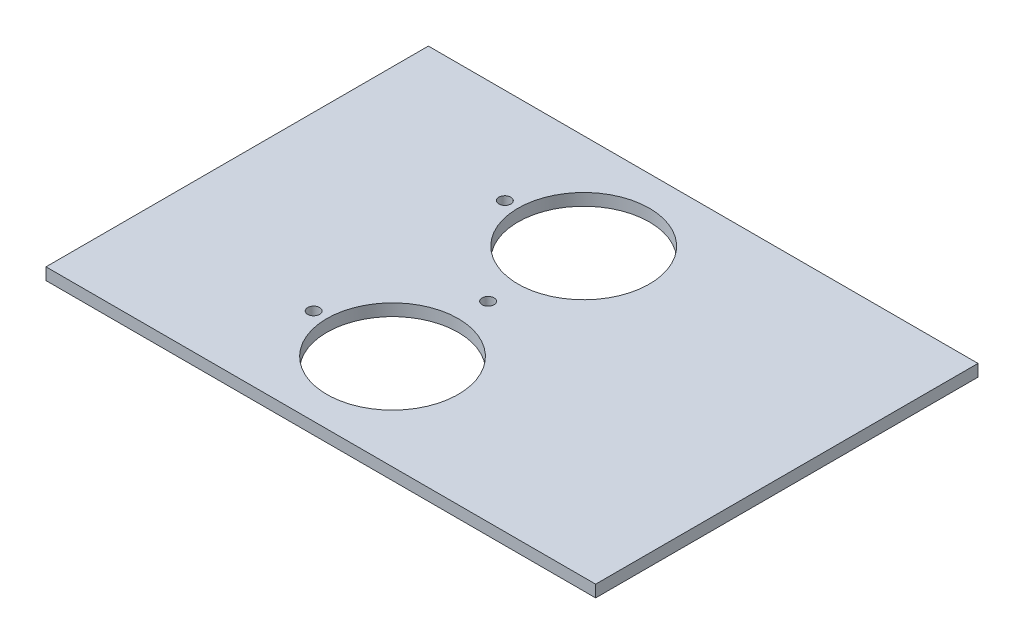
from build123d import *

# Parameters (mm, degrees)
SKETCH_1_W          = 250
SKETCH_1_H          = 160
EXTRUDE_1_DEPTH     = 5
CUT_EXTRUDE_1_REACH = 150.492
SKETCH_2_R          = 27.5
SKETCH_2_R_2        = 2.5
SKETCH_2_W          = 40
SKETCH_2_H          = 160


with BuildPart() as part:
    # 草图1 → 凸台-拉伸1 (new body)
    with BuildSketch(Plane(origin=(0, 0, 0), x_dir=(1, 0, 0), z_dir=(0, 1, 0))):
        Rectangle(SKETCH_1_W, SKETCH_1_H)
    extrude(amount=EXTRUDE_1_DEPTH)

    # 草图2 → 切除-拉伸1 (cut, up to next)
    with BuildSketch(Plane.XZ, mode=Mode.PRIVATE) as cut_extrude_1_sk1:
        with Locations(Location((0, -40, 0), (0, 0, 270))):
            Circle(SKETCH_2_R)
    cut_extrude_1_tool1 = extrude(cut_extrude_1_sk1.sketch, amount=-CUT_EXTRUDE_1_REACH, mode=Mode.PRIVATE) & part.part
    # 草图2 → 切除-拉伸1 (cut, up to next)
    with BuildSketch(Plane.XZ, mode=Mode.PRIVATE) as cut_extrude_1_sk2:
        with Locations(Location((-33, -40, 0), (0, 0, 270))):
            Circle(SKETCH_2_R_2)
    cut_extrude_1_tool2 = extrude(cut_extrude_1_sk2.sketch, amount=-CUT_EXTRUDE_1_REACH, mode=Mode.PRIVATE) & part.part
    # 草图2 → 切除-拉伸1 (cut, up to next)
    with BuildSketch(Plane.XZ, mode=Mode.PRIVATE) as cut_extrude_1_sk3:
        with Locations(Location((-33, 40, 0), (0, 0, 270))):
            Circle(SKETCH_2_R_2)
    cut_extrude_1_tool3 = extrude(cut_extrude_1_sk3.sketch, amount=-CUT_EXTRUDE_1_REACH, mode=Mode.PRIVATE) & part.part
    # 草图2 → 切除-拉伸1 (cut, up to next)
    with BuildSketch(Plane.XZ, mode=Mode.PRIVATE) as cut_extrude_1_sk4:
        with Locations(Location((0, 40, 0), (0, 0, 270))):
            Circle(SKETCH_2_R)
    cut_extrude_1_tool4 = extrude(cut_extrude_1_sk4.sketch, amount=-CUT_EXTRUDE_1_REACH, mode=Mode.PRIVATE) & part.part
    # 草图2 → 切除-拉伸1 (cut, up to next)
    with BuildSketch(Plane.XZ, mode=Mode.PRIVATE) as cut_extrude_1_sk5:
        with Locations(Location((0, 0, 0), (0, 0, 270))):
            Circle(SKETCH_2_R_2)
    cut_extrude_1_tool5 = extrude(cut_extrude_1_sk5.sketch, amount=-CUT_EXTRUDE_1_REACH, mode=Mode.PRIVATE) & part.part
    # 草图2 → 切除-拉伸1 (cut, up to next)
    with BuildSketch(Plane.XZ, mode=Mode.PRIVATE) as cut_extrude_1_sk6:
        with Locations((-125, 0)):
            Rectangle(SKETCH_2_W, SKETCH_2_H)
    cut_extrude_1_tool6 = extrude(cut_extrude_1_sk6.sketch, amount=-CUT_EXTRUDE_1_REACH, mode=Mode.PRIVATE) & part.part
    add(cut_extrude_1_tool1.solids().sort_by_distance((0, 0, -40))[0], mode=Mode.SUBTRACT)
    add(cut_extrude_1_tool2.solids().sort_by_distance((-33, 0, -40))[0], mode=Mode.SUBTRACT)
    add(cut_extrude_1_tool3.solids().sort_by_distance((-33, 0, 40))[0], mode=Mode.SUBTRACT)
    add(cut_extrude_1_tool4.solids().sort_by_distance((0, 0, 40))[0], mode=Mode.SUBTRACT)
    add(cut_extrude_1_tool5.solids().sort_by_distance((0, 0, 0))[0], mode=Mode.SUBTRACT)
    add(cut_extrude_1_tool6.solids().sort_by_distance((-125, 0, 0))[0], mode=Mode.SUBTRACT)


solid = part.part
